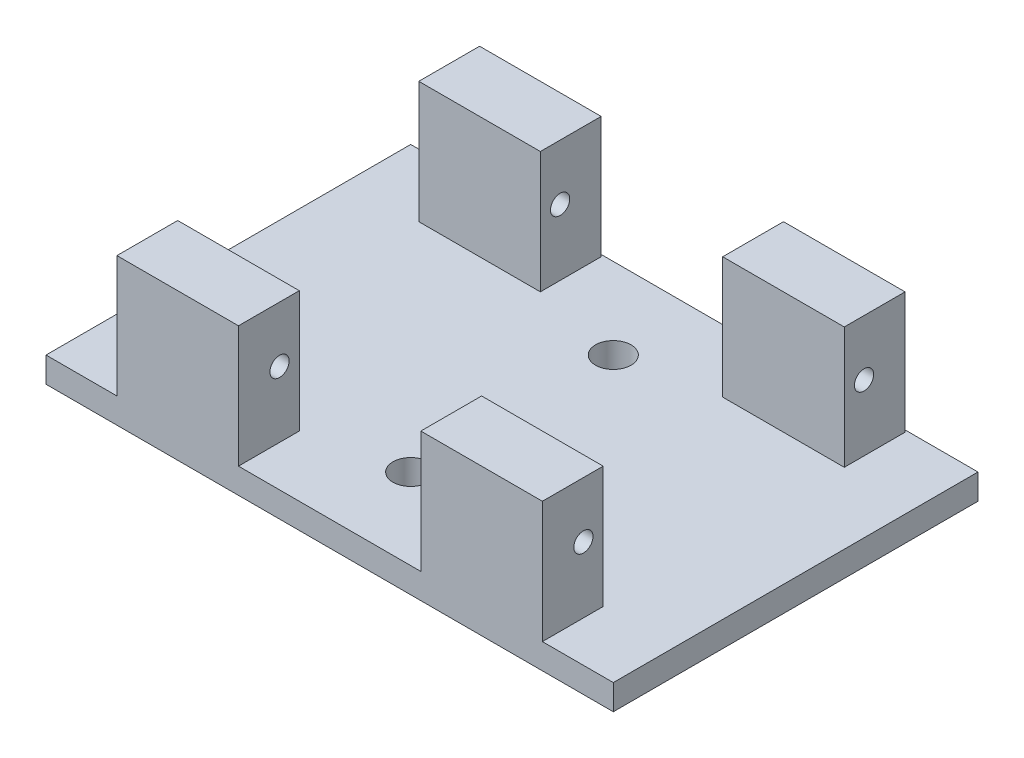
from build123d import *

# Parameters (mm, degrees)
SKETCH_1_W          = 56
SKETCH_1_H          = 36
EXTRUDE_1_DEPTH     = 2.5
SKETCH_2_W          = 12
SKETCH_2_H          = 6
EXTRUDE_2_DEPTH     = 12
SKETCH_3_R          = 0.95
CUT_EXTRUDE_1_DEPTH = 55.177947543
SKETCH_4_R          = 1.75
CUT_EXTRUDE_2_DEPTH = 36.383612026


with BuildPart() as part:
    # 草图1 → 凸台-拉伸1 (new body)
    with BuildSketch(Plane(origin=(0, 0, 0), x_dir=(1, 0, 0), z_dir=(0, 1, 0))):
        Rectangle(SKETCH_1_W, SKETCH_1_H)
    extrude(amount=EXTRUDE_1_DEPTH)

    # 草图2 → 凸台-拉伸2 (add)
    with BuildSketch(Plane(origin=(0, 2.5, 0), x_dir=(1, 0, 0), z_dir=(0, 1, 0))):
        with Locations((15, 14.8)):
            Rectangle(SKETCH_2_W, SKETCH_2_H)
        with Locations((15, -15)):
            Rectangle(SKETCH_2_W, SKETCH_2_H)
    extrude_2 = extrude(amount=EXTRUDE_2_DEPTH)

    # 草图3 → 切除-拉伸1 (cut, through all)
    with BuildSketch(Plane(origin=(21, 0, 0), x_dir=(0, 0, -1), z_dir=(1, 0, 0))):
        with Locations((-13.95, 9)):
            Circle(SKETCH_3_R)
        with Locations((13.75, 9)):
            Circle(SKETCH_3_R)
    cut_extrude_1 = extrude(amount=-CUT_EXTRUDE_1_DEPTH, mode=Mode.SUBTRACT)

    # 镜向1: 凸台-拉伸2, 切除-拉伸1 across plane
    add(extrude_2.mirror(Plane(origin=(0, 0, 0), x_dir=(0, 0, 1), z_dir=(1, 0, 0))))
    add(cut_extrude_1.mirror(Plane(origin=(0, 0, 0), x_dir=(0, 0, 1), z_dir=(1, 0, 0))), mode=Mode.SUBTRACT)

    # 草图4 → 切除-拉伸2 (cut, through all)
    with BuildSketch(Plane(origin=(0, 2.5, 0), x_dir=(1, 0, 0), z_dir=(0, 1, 0))):
        with Locations(Location((0, -10, 0), (0, 0, 270))):
            Circle(SKETCH_4_R)
        with Locations(Location((0, 10, 0), (0, 0, 270))):
            Circle(SKETCH_4_R)
    extrude(amount=-CUT_EXTRUDE_2_DEPTH, mode=Mode.SUBTRACT)


solid = part.part
